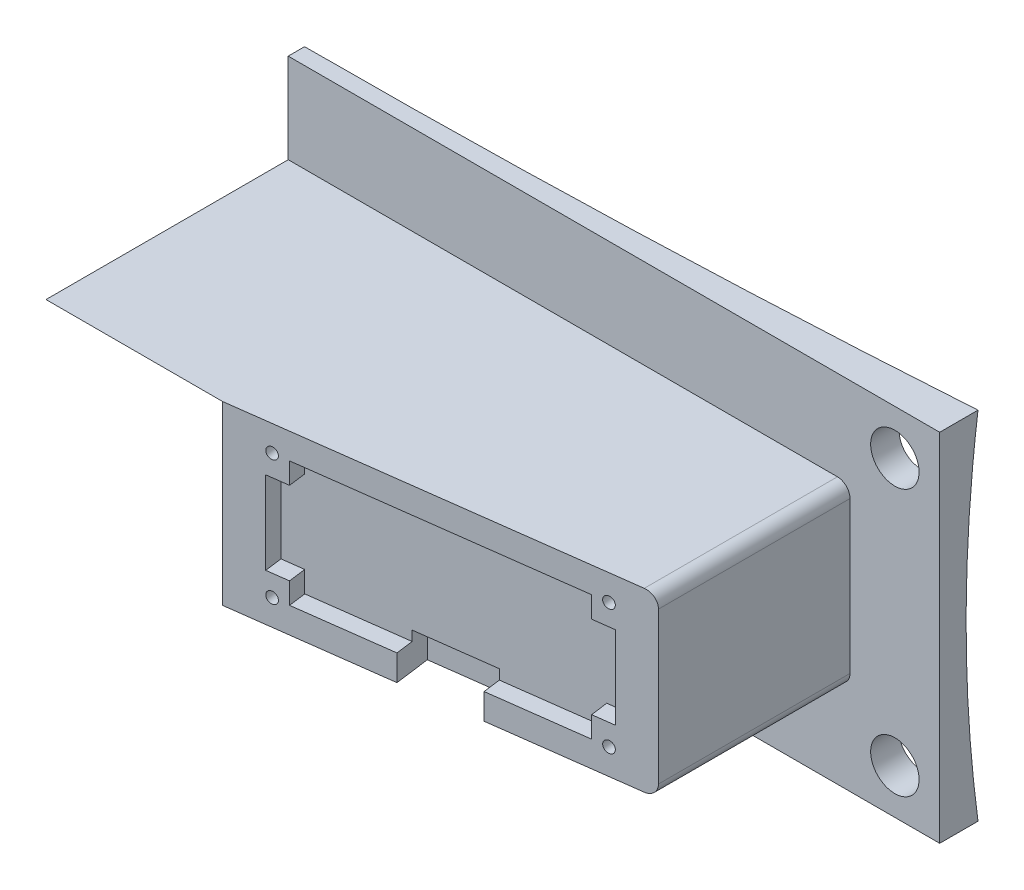
from build123d import *

# Parameters (mm, degrees)
BOSS_EXTRUDE4_DEPTH           = 25
CUT_EXTRUDE2_DEPTH            = 25
TAP_DRILL_FOR_4_40_TAP1_D     = 1.600000102
TAP_DRILL_FOR_4_40_TAP1_DEPTH = 7.874
TAP_DRILL_FOR_4_40_TAP1_TIP   = 0.480688526
TAP_DRILL_FOR_4_40_TAP3_D     = 1.600000102
TAP_DRILL_FOR_4_40_TAP3_DEPTH = 7.874
TAP_DRILL_FOR_4_40_TAP3_TIP   = 0.480688526
TAP_DRILL_FOR_4_40_TAP4_D     = 1.600000102
TAP_DRILL_FOR_4_40_TAP4_DEPTH = 7.874
TAP_DRILL_FOR_4_40_TAP4_TIP   = 0.480688526
FILLET1_R                     = 1.778
CUT_EXTRUDE3_DEPTH            = 2.5
CUT_EXTRUDE4_DEPTH            = 2.5
CUT_EXTRUDE5_DEPTH            = 2.5
SKETCH23_W                    = 11
SKETCH23_H                    = 5.045
CUT_EXTRUDE6_DEPTH            = 5
SKETCH24_W                    = 11
SKETCH24_H                    = 5.045
CUT_EXTRUDE7_DEPTH            = 5
SKETCH25_W                    = 11
SKETCH25_H                    = 16.07506189
CUT_EXTRUDE8_DEPTH            = 10
SKETCH26_W                    = 184.458934752
SKETCH26_H                    = 50.4
BOSS_EXTRUDE6_DEPTH           = 29.21
SKETCH27_R                    = 3.429
CUT_EXTRUDE9_DEPTH            = 106.37252383
SKETCH28_W                    = 115.917353875
SKETCH28_H                    = 112.19052099
CUT_EXTRUDE10_DEPTH           = 119.151659651


with BuildPart() as part:
    # Sketch6 → Boss-Extrude4 (new body)
    with BuildSketch(Plane(origin=(0, 0, 0), x_dir=(1, 0, 0), z_dir=(0, 1, 0))):
        Polygon((-79.529467376, 0), (79.529467376, 0), (79.529467376, -56.321059428), (25, -63.5), (-25, -63.5), (-79.529467376, -56.321059428), align=None)
    extrude(amount=BOSS_EXTRUDE4_DEPTH)

    # Sketch7 → Cut-Extrude2 (cut, symmetric)
    with BuildSketch(Plane(origin=(0, 0, 0), x_dir=(0, 0, -1), z_dir=(1, 0, 0))):
        Polygon((-63.5, 25), (-38.5, 0), (-63.5, 0), align=None)
    extrude(amount=CUT_EXTRUDE2_DEPTH, both=True, mode=Mode.SUBTRACT)

    # Tap Drill for #4-40 Tap1
    with Locations(Plane(origin=(0, -19.25, 19.25), x_dir=(-1, 0, 0), z_dir=(0, -0.7071067811865488, 0.7071067811865462))):
        with Locations((-21.255000035, -53.756280605), (21.255000035, -53.756280605), (21.255000035, -36.046280605), (-21.255000035, -36.046280605)):
            Hole(TAP_DRILL_FOR_4_40_TAP1_D / 2, depth=TAP_DRILL_FOR_4_40_TAP1_DEPTH)
            with Locations((0, 0, -(TAP_DRILL_FOR_4_40_TAP1_DEPTH + TAP_DRILL_FOR_4_40_TAP1_TIP / 2))):  # 118° drill point
                Cone(0, TAP_DRILL_FOR_4_40_TAP1_D / 2, TAP_DRILL_FOR_4_40_TAP1_TIP, mode=Mode.SUBTRACT)

    # Tap Drill for #4-40 Tap3
    with Locations(Plane(origin=(-8.643431853, 0, 65.653383048), x_dir=(0.9914448613738104, 0, 0.13052619222005213), z_dir=(-0.13052619222005213, 0, 0.9914448613738104))):
        with Locations((-65.252708328, 21.355), (-22.742708328, 21.355), (-22.742708328, 3.645), (-65.252708328, 3.645)):
            Hole(TAP_DRILL_FOR_4_40_TAP3_D / 2, depth=TAP_DRILL_FOR_4_40_TAP3_DEPTH)
            with Locations((0, 0, -(TAP_DRILL_FOR_4_40_TAP3_DEPTH + TAP_DRILL_FOR_4_40_TAP3_TIP / 2))):  # 118° drill point
                Cone(0, TAP_DRILL_FOR_4_40_TAP3_D / 2, TAP_DRILL_FOR_4_40_TAP3_TIP, mode=Mode.SUBTRACT)

    # Tap Drill for #4-40 Tap4
    with Locations(Plane(origin=(8.643431853, 0, 65.653383048), x_dir=(0.9914448613738104, 0, -0.13052619222005213), z_dir=(0.13052619222005213, 0, 0.9914448613738104))):
        with Locations((22.742708328, 21.355), (65.252708328, 21.355), (65.252708328, 3.645), (22.742708328, 3.645)):
            Hole(TAP_DRILL_FOR_4_40_TAP4_D / 2, depth=TAP_DRILL_FOR_4_40_TAP4_DEPTH)
            with Locations((0, 0, -(TAP_DRILL_FOR_4_40_TAP4_DEPTH + TAP_DRILL_FOR_4_40_TAP4_TIP / 2))):  # 118° drill point
                Cone(0, TAP_DRILL_FOR_4_40_TAP4_D / 2, TAP_DRILL_FOR_4_40_TAP4_TIP, mode=Mode.SUBTRACT)

    # Fillet1
    fillet1_edges = [part.edges().sort_by_distance(p)[0] for p in [
        (-79.529467376, 25, 28.160529714),
        (79.529467376, 25, 28.160529714),
        (-79.529467376, 0, 28.160529714),
        (79.529467376, 0, 28.160529714),
    ]]
    fillet(fillet1_edges, radius=FILLET1_R)

    # Sketch22 → Cut-Extrude3 (cut)
    with BuildSketch(Plane(origin=(0, -19.25, 19.25), x_dir=(1, 0, 0), z_dir=(0, -0.7071067811865488, 0.7071067811865462))):
        Polygon((-19.055000086, 53.756280605), (-19.055000086, 50.756280605), (-22.055000086, 50.756280605), (-22.055000086, 39.046280605), (-19.055000086, 39.046280605), (-19.055000086, 36.046280605), (19.055000086, 36.046280605), (19.055000086, 39.046280605), (22.055000086, 39.046280605), (22.055000086, 50.756280605), (19.055000086, 50.756280605), (19.055000086, 53.756280605), align=None)
    extrude(amount=-CUT_EXTRUDE3_DEPTH, mode=Mode.SUBTRACT)

    # Sketch21 → Cut-Extrude4 (cut)
    with BuildSketch(Plane(origin=(8.643431853, 0, 65.653383048), x_dir=(0.9914448613738104, 0, -0.13052619222005213), z_dir=(0.13052619222005213, 0, 0.9914448613738104))):
        Polygon((24.942708277, 21.355), (24.942708277, 18.355), (21.942708277, 18.355), (21.942708277, 6.645), (24.942708277, 6.645), (24.942708277, 3.645), (63.052708379, 3.645), (63.052708379, 6.645), (66.052708379, 6.645), (66.052708379, 18.355), (63.052708379, 18.355), (63.052708379, 21.355), align=None)
    extrude(amount=-CUT_EXTRUDE4_DEPTH, mode=Mode.SUBTRACT)

    # Sketch20 → Cut-Extrude5 (cut)
    with BuildSketch(Plane(origin=(-8.643431853, 0, 65.653383048), x_dir=(0.9914448613738104, 0, 0.13052619222005213), z_dir=(-0.13052619222005213, 0, 0.9914448613738104))):
        Polygon((-63.052708379, 21.355), (-63.052708379, 18.355), (-66.052708379, 18.355), (-66.052708379, 6.645), (-63.052708379, 6.645), (-63.052708379, 3.645), (-24.942708277, 3.645), (-24.942708277, 6.645), (-21.942708277, 6.645), (-21.942708277, 18.355), (-24.942708277, 18.355), (-24.942708277, 21.355), align=None)
    extrude(amount=-CUT_EXTRUDE5_DEPTH, mode=Mode.SUBTRACT)

    # Sketch23 → Cut-Extrude6 (cut)
    with BuildSketch(Plane(origin=(8.643431853, 0, 65.653383048), x_dir=(0.9914448613738104, 0, -0.13052619222005213), z_dir=(0.13052619222005213, 0, 0.9914448613738104))):
        with Locations((43.997708328, 2.5225)):
            Rectangle(SKETCH23_W, SKETCH23_H)
    extrude(amount=-CUT_EXTRUDE6_DEPTH, mode=Mode.SUBTRACT)

    # Sketch24 → Cut-Extrude7 (cut)
    with BuildSketch(Plane(origin=(-8.643431853, 0, 65.653383048), x_dir=(0.9914448613738104, 0, 0.13052619222005213), z_dir=(-0.13052619222005213, 0, 0.9914448613738104))):
        with Locations((-43.997708328, 2.5225)):
            Rectangle(SKETCH24_W, SKETCH24_H)
    extrude(amount=-CUT_EXTRUDE7_DEPTH, mode=Mode.SUBTRACT)

    # Sketch25 → Cut-Extrude8 (cut)
    with BuildSketch(Plane(origin=(0, -19.25, 19.25), x_dir=(1, 0, 0), z_dir=(0, -0.7071067811865488, 0.7071067811865462))):
        with Locations((0, 29.40874966)):
            Rectangle(SKETCH25_W, SKETCH25_H)
    extrude(amount=-CUT_EXTRUDE8_DEPTH, mode=Mode.SUBTRACT)

    # Sketch26 → Boss-Extrude6 (add)
    with BuildSketch(Plane(origin=(0, 0, 0), x_dir=(-1, 0, 0), z_dir=(0, 0, -1))):
        with Locations((0, 12.5)):
            Rectangle(SKETCH26_W, SKETCH26_H)
    extrude(amount=-BOSS_EXTRUDE6_DEPTH)

    # Sketch11 → Cut-Revolve4 (revolve, cut)
    with BuildSketch(Plane(origin=(0, 0, 0), x_dir=(0, 0, -1), z_dir=(1, 0, 0))):
        with BuildLine():
            Line((1344.295, -496.77), (1344.295, 521.77))
            add(Edge.make_bspline(
                [(1344.295, 521.77), (-28.575, 521.77), (-28.575, 12.5), (-28.575, -496.77), (1344.295, -496.77)],
                knots=[4.71238898, 4.71238898, 4.71238898, 6.283185307, 6.283185307, 7.853981634, 7.853981634, 7.853981634], degree=2, weights=[1, 0.707106781, 1, 0.707106781, 1]))
        make_face()
    revolve(axis=Axis((0, -496.77, -1344.295), (0, 1, 0)), mode=Mode.SUBTRACT)

    # Sketch27 → Cut-Extrude9 (cut, through all)
    with BuildSketch(Plane.XY.offset(29.21)):
        with Locations((85.879467376, -6.35)):
            Circle(SKETCH27_R)
        with Locations((-85.879467376, -6.35)):
            Circle(SKETCH27_R)
        with Locations((-85.879467376, 31.35)):
            Circle(SKETCH27_R)
        with Locations((85.879467376, 31.35)):
            Circle(SKETCH27_R)
    extrude(amount=-CUT_EXTRUDE9_DEPTH, mode=Mode.SUBTRACT)

    # Sketch28 → Cut-Extrude10 (cut, through all)
    with BuildSketch(Plane(origin=(0, 0, 0), x_dir=(0, 0, -1), z_dir=(1, 0, 0))):
        with Locations((-70.629213931, -16.061676163)):
            Rectangle(SKETCH28_W, SKETCH28_H)
    extrude(amount=-CUT_EXTRUDE10_DEPTH, mode=Mode.SUBTRACT)


solid = part.part
